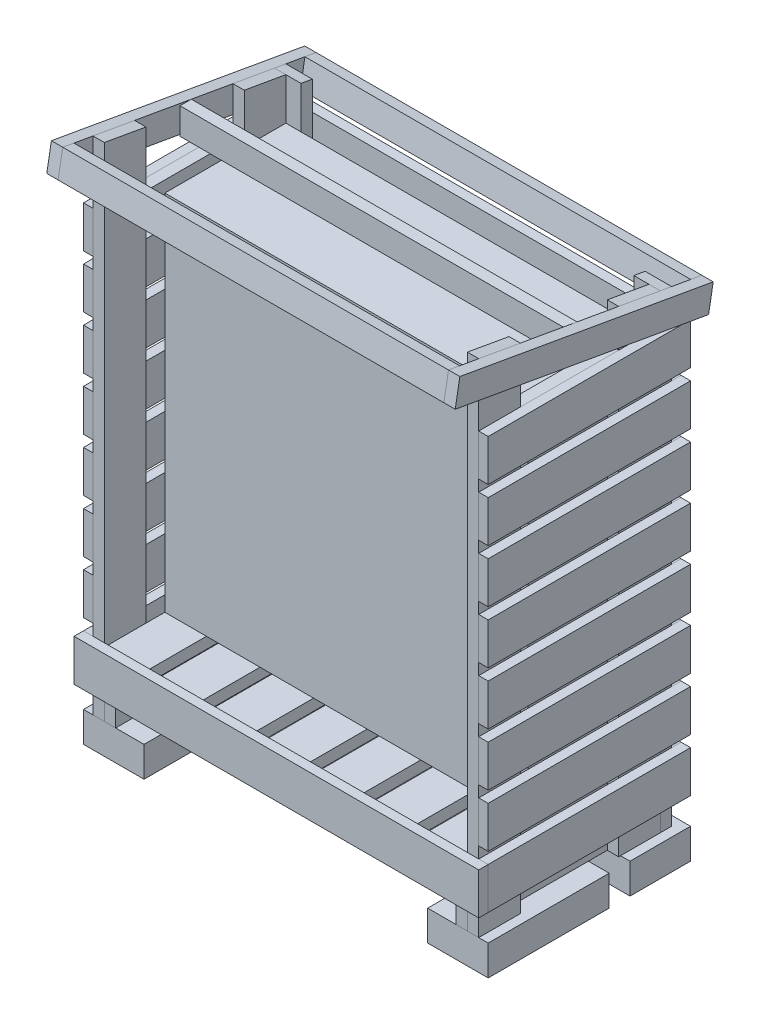
from build123d import *

# Parameters (mm, degrees)
SKETCH5_W              = 38.1
SKETCH5_H              = 609.6
BOSS_EXTRUDE2_DEPTH    = 88.9
BOSS_EXTRUDE2_2_DEPTH  = 88.9
SKETCH6_W              = 1219.2
SKETCH6_H              = 38.1
BOSS_EXTRUDE3_DEPTH    = 88.9
BOSS_EXTRUDE3_2_DEPTH  = 88.9
SKETCH7_W              = 139.7
SKETCH7_H              = 609.6
BOSS_EXTRUDE4_DEPTH    = 38.1
BOSS_EXTRUDE4_2_DEPTH  = 38.1
BOSS_EXTRUDE4_3_DEPTH  = 38.1
BOSS_EXTRUDE4_4_DEPTH  = 38.1
BOSS_EXTRUDE4_5_DEPTH  = 38.1
BOSS_EXTRUDE4_6_DEPTH  = 38.1
BOSS_EXTRUDE4_7_DEPTH  = 38.1
SKETCH10_W             = 38.1
SKETCH10_H             = 139.7
BOSS_EXTRUDE7_DEPTH    = 1828.8
BOSS_EXTRUDE7_2_DEPTH  = 1828.8
BOSS_EXTRUDE7_3_DEPTH  = 1828.8
BOSS_EXTRUDE7_4_DEPTH  = 1828.8
SKETCH16_W             = 88.9
SKETCH16_H             = 38.1
BOSS_EXTRUDE11_DEPTH   = 1828.8
BOSS_EXTRUDE11_2_DEPTH = 1828.8
SKETCH12_W             = 1219.1492
SKETCH12_H             = 406.4
BOSS_EXTRUDE8_DEPTH    = 1219.2
BOSS_EXTRUDE9_DEPTH    = 38.1
CUT_EXTRUDE1_DEPTH     = 2237.750882419
BOSS_EXTRUDE10_DEPTH   = 1295.4
BOSS_EXTRUDE10_2_DEPTH = 1295.4
SKETCH15_W             = 38.1
SKETCH15_H             = 88.9
BOSS_EXTRUDE10_3_DEPTH = 1295.4
SKETCH18_W             = 1295.4
SKETCH18_H             = 139.7
BOSS_EXTRUDE12_DEPTH   = 31.75
BOSS_EXTRUDE12_2_DEPTH = 31.75
BOSS_EXTRUDE12_3_DEPTH = 31.75
BOSS_EXTRUDE12_4_DEPTH = 31.75
BOSS_EXTRUDE12_5_DEPTH = 31.75
BOSS_EXTRUDE12_6_DEPTH = 31.75
BOSS_EXTRUDE12_7_DEPTH = 31.75
BOSS_EXTRUDE12_8_DEPTH = 31.75
SKETCH20_W             = 679.45
SKETCH20_H             = 139.7
BOSS_EXTRUDE13_DEPTH   = 31.75
BOSS_EXTRUDE13_2_DEPTH = 31.75
BOSS_EXTRUDE13_3_DEPTH = 31.75
BOSS_EXTRUDE13_4_DEPTH = 31.75
BOSS_EXTRUDE13_5_DEPTH = 31.75
BOSS_EXTRUDE13_6_DEPTH = 31.75
BOSS_EXTRUDE13_7_DEPTH = 31.75
BOSS_EXTRUDE13_8_DEPTH = 31.75
SKETCH21_W             = 203.2
SKETCH21_H             = 406.4
BOSS_EXTRUDE14_DEPTH   = 101.6
BOSS_EXTRUDE14_2_DEPTH = 101.6
SKETCH21_W_2           = 406.4
SKETCH21_H_2           = 203.2
BOSS_EXTRUDE14_3_DEPTH = 101.6
BOSS_EXTRUDE14_4_DEPTH = 101.6
SKETCH22_W             = 1358.9
SKETCH22_H             = 139.7
BOSS_EXTRUDE15_DEPTH   = 31.75
SKETCH23_W             = 38.1
SKETCH23_H             = 88.9
BOSS_EXTRUDE16_DEPTH   = 330.2
BOSS_EXTRUDE16_2_DEPTH = 330.2


with BuildPart() as part:
    # Sketch5 → Boss-Extrude2 (new body)
    with BuildSketch(Plane(origin=(0, 0, 0), x_dir=(1, 0, 0), z_dir=(0, 1, 0))):
        with Locations((-590.55, 0)):
            Rectangle(SKETCH5_W, SKETCH5_H)
    extrude(amount=-BOSS_EXTRUDE2_DEPTH)


with BuildPart() as body_2:
    # Sketch5 → Boss-Extrude2 2 (new body)
    with BuildSketch(Plane(origin=(0, 0, 0), x_dir=(1, 0, 0), z_dir=(0, 1, 0))):
        with Locations((590.55, 0)):
            Rectangle(SKETCH5_W, SKETCH5_H)
    extrude(amount=-BOSS_EXTRUDE2_2_DEPTH)


with BuildPart() as body_3:
    # Sketch6 → Boss-Extrude3 (new body)
    with BuildSketch(Plane(origin=(0, 0, 0), x_dir=(1, 0, 0), z_dir=(0, 1, 0))):
        with Locations((0, -285.75)):
            Rectangle(SKETCH6_W, SKETCH6_H)
    extrude(amount=BOSS_EXTRUDE3_DEPTH)


with BuildPart() as body_4:
    # Sketch6 → Boss-Extrude3 2 (new body)
    with BuildSketch(Plane(origin=(0, 0, 0), x_dir=(1, 0, 0), z_dir=(0, 1, 0))):
        with Locations((0, 285.75)):
            Rectangle(SKETCH6_W, SKETCH6_H)
    extrude(amount=BOSS_EXTRUDE3_2_DEPTH)


with BuildPart() as body_5:
    # Sketch7 → Boss-Extrude4 (new body)
    with BuildSketch(Plane(origin=(0, 88.9, 0), x_dir=(1, 0, 0), z_dir=(0, 1, 0))):
        with Locations((-539.75, 0)):
            Rectangle(SKETCH7_W, SKETCH7_H)
    extrude(amount=BOSS_EXTRUDE4_DEPTH)


with BuildPart() as body_6:
    # Sketch7 → Boss-Extrude4 2 (new body)
    with BuildSketch(Plane(origin=(0, 88.9, 0), x_dir=(1, 0, 0), z_dir=(0, 1, 0))):
        with Locations((-359.8418, 0)):
            Rectangle(SKETCH7_W, SKETCH7_H)
    extrude(amount=BOSS_EXTRUDE4_2_DEPTH)


with BuildPart() as body_7:
    # Sketch7 → Boss-Extrude4 3 (new body)
    with BuildSketch(Plane(origin=(0, 88.9, 0), x_dir=(1, 0, 0), z_dir=(0, 1, 0))):
        with Locations((-179.9336, 0)):
            Rectangle(SKETCH7_W, SKETCH7_H)
    extrude(amount=BOSS_EXTRUDE4_3_DEPTH)


with BuildPart() as body_8:
    # Sketch7 → Boss-Extrude4 4 (new body)
    with BuildSketch(Plane(origin=(0, 88.9, 0), x_dir=(1, 0, 0), z_dir=(0, 1, 0))):
        with Locations((-0.0254, 0)):
            Rectangle(SKETCH7_W, SKETCH7_H)
    extrude(amount=BOSS_EXTRUDE4_4_DEPTH)


with BuildPart() as body_9:
    # Sketch7 → Boss-Extrude4 5 (new body)
    with BuildSketch(Plane(origin=(0, 88.9, 0), x_dir=(1, 0, 0), z_dir=(0, 1, 0))):
        with Locations((179.8828, 0)):
            Rectangle(SKETCH7_W, SKETCH7_H)
    extrude(amount=BOSS_EXTRUDE4_5_DEPTH)


with BuildPart() as body_10:
    # Sketch7 → Boss-Extrude4 6 (new body)
    with BuildSketch(Plane(origin=(0, 88.9, 0), x_dir=(1, 0, 0), z_dir=(0, 1, 0))):
        with Locations((359.791, 0)):
            Rectangle(SKETCH7_W, SKETCH7_H)
    extrude(amount=BOSS_EXTRUDE4_6_DEPTH)


with BuildPart() as body_11:
    # Sketch7 → Boss-Extrude4 7 (new body)
    with BuildSketch(Plane(origin=(0, 88.9, 0), x_dir=(1, 0, 0), z_dir=(0, 1, 0))):
        with Locations((539.6992, 0)):
            Rectangle(SKETCH7_W, SKETCH7_H)
    extrude(amount=BOSS_EXTRUDE4_7_DEPTH)


with BuildPart() as body_12:
    # Sketch10 → Boss-Extrude7 (new body)
    with BuildSketch(Plane.XZ.offset(88.9)):
        with Locations((-628.65, 234.95)):
            Rectangle(SKETCH10_W, SKETCH10_H)
    extrude(amount=-BOSS_EXTRUDE7_DEPTH)


with BuildPart() as body_13:
    # Sketch10 → Boss-Extrude7 2 (new body)
    with BuildSketch(Plane.XZ.offset(88.9)):
        with Locations((-628.65, -234.95)):
            Rectangle(SKETCH10_W, SKETCH10_H)
    extrude(amount=-BOSS_EXTRUDE7_2_DEPTH)


with BuildPart() as body_14:
    # Sketch10 → Boss-Extrude7 3 (new body)
    with BuildSketch(Plane.XZ.offset(88.9)):
        with Locations((628.65, 234.95)):
            Rectangle(SKETCH10_W, SKETCH10_H)
    extrude(amount=-BOSS_EXTRUDE7_3_DEPTH)


with BuildPart() as body_15:
    # Sketch10 → Boss-Extrude7 4 (new body)
    with BuildSketch(Plane.XZ.offset(88.9)):
        with Locations((628.65, -234.95)):
            Rectangle(SKETCH10_W, SKETCH10_H)
    extrude(amount=-BOSS_EXTRUDE7_4_DEPTH)


with BuildPart() as body_16:
    # Sketch16 → Boss-Extrude11 (new body)
    with BuildSketch(Plane.XZ.offset(88.9)):
        with Locations((-603.25, -323.85)):
            Rectangle(SKETCH16_W, SKETCH16_H)
    extrude(amount=-BOSS_EXTRUDE11_DEPTH)


with BuildPart() as body_17:
    # Sketch16 → Boss-Extrude11 2 (new body)
    with BuildSketch(Plane.XZ.offset(88.9)):
        with Locations((603.25, -323.85)):
            Rectangle(SKETCH16_W, SKETCH16_H)
    extrude(amount=-BOSS_EXTRUDE11_2_DEPTH)


with BuildPart() as body_18:
    # Sketch12 → Boss-Extrude8 (new body)
    with BuildSketch(Plane(origin=(0, 127, 0), x_dir=(1, 0, 0), z_dir=(0, 1, 0))):
        with Locations((-0.0254, 101.6)):
            Rectangle(SKETCH12_W, SKETCH12_H)
    extrude(amount=BOSS_EXTRUDE8_DEPTH)


with BuildPart() as body_19:
    # Sketch13 → Boss-Extrude9 (new body)
    with BuildSketch(Plane(origin=(647.7, 0, 0), x_dir=(0, 0, -1), z_dir=(1, 0, 0))):
        Polygon((429.062677005, 1375.089137349), (-421.837322995, 1525.125765234), (-406.4, 1612.675174476), (444.5, 1462.638546592), align=None)
    extrude(amount=BOSS_EXTRUDE9_DEPTH)


with BuildPart() as body_20:
    # Mirror1: mirrored copy
    add(body_19.part.mirror(Plane(origin=(0, 0, 0), x_dir=(0, 0, 1), z_dir=(1, 0, 0))))


with BuildPart() as cut_extrude1_tool:
    # Sketch14 → Cut-Extrude1 (new, through all)
    with BuildSketch(Plane(origin=(647.7, 0, 0), x_dir=(0, 0, -1), z_dir=(1, 0, 0))):
        Polygon((-304.8, 1739.9), (-304.8, 1594.760353237), (342.9, 1480.553367832), (342.9, 1739.9), align=None)
    extrude(amount=-CUT_EXTRUDE1_DEPTH)


with BuildPart() as body_12_1:
    add(body_12.part)

    # Cut-Extrude1: cut by cut_extrude1_tool
    add(cut_extrude1_tool.part, mode=Mode.SUBTRACT)


with BuildPart() as body_13_1:
    add(body_13.part)

    # Cut-Extrude1: cut by cut_extrude1_tool
    add(cut_extrude1_tool.part, mode=Mode.SUBTRACT)


with BuildPart() as body_14_1:
    add(body_14.part)

    # Cut-Extrude1: cut by cut_extrude1_tool
    add(cut_extrude1_tool.part, mode=Mode.SUBTRACT)


with BuildPart() as body_15_1:
    add(body_15.part)

    # Cut-Extrude1: cut by cut_extrude1_tool
    add(cut_extrude1_tool.part, mode=Mode.SUBTRACT)


with BuildPart() as body_16_1:
    add(body_16.part)

    # Cut-Extrude1: cut by cut_extrude1_tool
    add(cut_extrude1_tool.part, mode=Mode.SUBTRACT)


with BuildPart() as body_17_1:
    add(body_17.part)

    # Cut-Extrude1: cut by cut_extrude1_tool
    add(cut_extrude1_tool.part, mode=Mode.SUBTRACT)


with BuildPart() as body_21:
    # Sketch15 → Boss-Extrude10 (new body)
    with BuildSketch(Plane(origin=(-647.7, 0, 0), x_dir=(0, 0, -1), z_dir=(1, 0, 0))):
        Polygon((-406.4, 1612.675174476), (-421.837322995, 1525.125765234), (-384.316147605, 1518.509769665), (-368.87882461, 1606.059178907), align=None)
    extrude(amount=BOSS_EXTRUDE10_DEPTH)


with BuildPart() as body_22:
    # Sketch15 → Boss-Extrude10 2 (new body)
    with BuildSketch(Plane(origin=(-647.7, 0, 0), x_dir=(0, 0, -1), z_dir=(1, 0, 0))):
        Polygon((444.5, 1462.638546592), (406.97882461, 1469.254542161), (391.541501616, 1381.705132918), (429.062677005, 1375.089137349), align=None)
    extrude(amount=BOSS_EXTRUDE10_2_DEPTH)


with BuildPart() as body_23:
    # Sketch15 → Boss-Extrude10 3 (new body)
    with BuildSketch(Plane(origin=(-647.7, 0, 0), x_dir=(0, 0, -1), z_dir=(1, 0, 0))):
        with Locations((6.35, 1492.087184207)):
            Rectangle(SKETCH15_W, SKETCH15_H)
    extrude(amount=BOSS_EXTRUDE10_3_DEPTH)


with BuildPart() as body_24:
    # Sketch18 → Boss-Extrude12 (new body)
    with BuildSketch(Plane(origin=(0, 0, -342.9), x_dir=(-1, 0, 0), z_dir=(0, 0, -1))):
        with Locations((0, 69.85)):
            Rectangle(SKETCH18_W, SKETCH18_H)
    extrude(amount=BOSS_EXTRUDE12_DEPTH)


with BuildPart() as body_25:
    # Sketch18 → Boss-Extrude12 2 (new body)
    with BuildSketch(Plane(origin=(0, 0, -342.9), x_dir=(-1, 0, 0), z_dir=(0, 0, -1))):
        with Locations((0, 958.85)):
            Rectangle(SKETCH18_W, SKETCH18_H)
    extrude(amount=BOSS_EXTRUDE12_2_DEPTH)


with BuildPart() as body_26:
    # Sketch18 → Boss-Extrude12 3 (new body)
    with BuildSketch(Plane(origin=(0, 0, -342.9), x_dir=(-1, 0, 0), z_dir=(0, 0, -1))):
        with Locations((0, 247.65)):
            Rectangle(SKETCH18_W, SKETCH18_H)
    extrude(amount=BOSS_EXTRUDE12_3_DEPTH)


with BuildPart() as body_27:
    # Sketch18 → Boss-Extrude12 4 (new body)
    with BuildSketch(Plane(origin=(0, 0, -342.9), x_dir=(-1, 0, 0), z_dir=(0, 0, -1))):
        with Locations((0, 425.45)):
            Rectangle(SKETCH18_W, SKETCH18_H)
    extrude(amount=BOSS_EXTRUDE12_4_DEPTH)


with BuildPart() as body_28:
    # Sketch18 → Boss-Extrude12 5 (new body)
    with BuildSketch(Plane(origin=(0, 0, -342.9), x_dir=(-1, 0, 0), z_dir=(0, 0, -1))):
        with Locations((0, 603.25)):
            Rectangle(SKETCH18_W, SKETCH18_H)
    extrude(amount=BOSS_EXTRUDE12_5_DEPTH)


with BuildPart() as body_29:
    # Sketch18 → Boss-Extrude12 6 (new body)
    with BuildSketch(Plane(origin=(0, 0, -342.9), x_dir=(-1, 0, 0), z_dir=(0, 0, -1))):
        with Locations((0, 781.05)):
            Rectangle(SKETCH18_W, SKETCH18_H)
    extrude(amount=BOSS_EXTRUDE12_6_DEPTH)


with BuildPart() as body_30:
    # Sketch18 → Boss-Extrude12 7 (new body)
    with BuildSketch(Plane(origin=(0, 0, -342.9), x_dir=(-1, 0, 0), z_dir=(0, 0, -1))):
        with Locations((0, 1136.65)):
            Rectangle(SKETCH18_W, SKETCH18_H)
    extrude(amount=BOSS_EXTRUDE12_7_DEPTH)


with BuildPart() as body_31:
    # Sketch18 → Boss-Extrude12 8 (new body)
    with BuildSketch(Plane(origin=(0, 0, -342.9), x_dir=(-1, 0, 0), z_dir=(0, 0, -1))):
        with Locations((0, 1314.45)):
            Rectangle(SKETCH18_W, SKETCH18_H)
    extrude(amount=BOSS_EXTRUDE12_8_DEPTH)


with BuildPart() as body_32:
    # Sketch20 → Boss-Extrude13 (new body)
    with BuildSketch(Plane(origin=(647.7, 0, 0), x_dir=(0, 0, -1), z_dir=(1, 0, 0))):
        with Locations((34.925, 69.85)):
            Rectangle(SKETCH20_W, SKETCH20_H)
    extrude(amount=BOSS_EXTRUDE13_DEPTH)


with BuildPart() as body_33:
    # Sketch20 → Boss-Extrude13 2 (new body)
    with BuildSketch(Plane(origin=(647.7, 0, 0), x_dir=(0, 0, -1), z_dir=(1, 0, 0))):
        with Locations((34.925, 247.65)):
            Rectangle(SKETCH20_W, SKETCH20_H)
    extrude(amount=BOSS_EXTRUDE13_2_DEPTH)


with BuildPart() as body_34:
    # Sketch20 → Boss-Extrude13 3 (new body)
    with BuildSketch(Plane(origin=(647.7, 0, 0), x_dir=(0, 0, -1), z_dir=(1, 0, 0))):
        with Locations((34.925, 425.45)):
            Rectangle(SKETCH20_W, SKETCH20_H)
    extrude(amount=BOSS_EXTRUDE13_3_DEPTH)


with BuildPart() as body_35:
    # Sketch20 → Boss-Extrude13 4 (new body)
    with BuildSketch(Plane(origin=(647.7, 0, 0), x_dir=(0, 0, -1), z_dir=(1, 0, 0))):
        with Locations((34.925, 603.25)):
            Rectangle(SKETCH20_W, SKETCH20_H)
    extrude(amount=BOSS_EXTRUDE13_4_DEPTH)


with BuildPart() as body_36:
    # Sketch20 → Boss-Extrude13 5 (new body)
    with BuildSketch(Plane(origin=(647.7, 0, 0), x_dir=(0, 0, -1), z_dir=(1, 0, 0))):
        with Locations((34.925, 781.05)):
            Rectangle(SKETCH20_W, SKETCH20_H)
    extrude(amount=BOSS_EXTRUDE13_5_DEPTH)


with BuildPart() as body_37:
    # Sketch20 → Boss-Extrude13 6 (new body)
    with BuildSketch(Plane(origin=(647.7, 0, 0), x_dir=(0, 0, -1), z_dir=(1, 0, 0))):
        with Locations((34.925, 958.85)):
            Rectangle(SKETCH20_W, SKETCH20_H)
    extrude(amount=BOSS_EXTRUDE13_6_DEPTH)


with BuildPart() as body_38:
    # Sketch20 → Boss-Extrude13 7 (new body)
    with BuildSketch(Plane(origin=(647.7, 0, 0), x_dir=(0, 0, -1), z_dir=(1, 0, 0))):
        with Locations((34.925, 1136.65)):
            Rectangle(SKETCH20_W, SKETCH20_H)
    extrude(amount=BOSS_EXTRUDE13_7_DEPTH)


with BuildPart() as body_39:
    # Sketch20 → Boss-Extrude13 8 (new body)
    with BuildSketch(Plane(origin=(647.7, 0, 0), x_dir=(0, 0, -1), z_dir=(1, 0, 0))):
        with Locations((34.925, 1314.45)):
            Rectangle(SKETCH20_W, SKETCH20_H)
    extrude(amount=BOSS_EXTRUDE13_8_DEPTH)


with BuildPart() as body_40:
    # Mirror2: mirrored copy
    add(body_36.part.mirror(Plane(origin=(0, 0, 0), x_dir=(0, 0, 1), z_dir=(1, 0, 0))))


with BuildPart() as body_41:
    # Mirror2 2: mirrored copy
    add(body_35.part.mirror(Plane(origin=(0, 0, 0), x_dir=(0, 0, 1), z_dir=(1, 0, 0))))


with BuildPart() as body_42:
    # Mirror2 3: mirrored copy
    add(body_34.part.mirror(Plane(origin=(0, 0, 0), x_dir=(0, 0, 1), z_dir=(1, 0, 0))))


with BuildPart() as body_43:
    # Mirror2 4: mirrored copy
    add(body_33.part.mirror(Plane(origin=(0, 0, 0), x_dir=(0, 0, 1), z_dir=(1, 0, 0))))


with BuildPart() as body_44:
    # Mirror2 5: mirrored copy
    add(body_32.part.mirror(Plane(origin=(0, 0, 0), x_dir=(0, 0, 1), z_dir=(1, 0, 0))))


with BuildPart() as body_45:
    # Mirror2 6: mirrored copy
    add(body_37.part.mirror(Plane(origin=(0, 0, 0), x_dir=(0, 0, 1), z_dir=(1, 0, 0))))


with BuildPart() as body_46:
    # Mirror2 7: mirrored copy
    add(body_38.part.mirror(Plane(origin=(0, 0, 0), x_dir=(0, 0, 1), z_dir=(1, 0, 0))))


with BuildPart() as body_47:
    # Mirror2 8: mirrored copy
    add(body_39.part.mirror(Plane(origin=(0, 0, 0), x_dir=(0, 0, 1), z_dir=(1, 0, 0))))


with BuildPart() as body_48:
    # Sketch21 → Boss-Extrude14 (new body)
    with BuildSketch(Plane.XZ.offset(88.9)):
        with Locations((-577.85, 101.6)):
            Rectangle(SKETCH21_W, SKETCH21_H)
    extrude(amount=BOSS_EXTRUDE14_DEPTH)


with BuildPart() as body_49:
    # Sketch21 → Boss-Extrude14 2 (new body)
    with BuildSketch(Plane.XZ.offset(88.9)):
        with Locations((577.85, 101.6)):
            Rectangle(SKETCH21_W, SKETCH21_H)
    extrude(amount=BOSS_EXTRUDE14_2_DEPTH)


with BuildPart() as body_50:
    # Sketch21 → Boss-Extrude14 3 (new body)
    with BuildSketch(Plane.XZ.offset(88.9)):
        with Locations((-476.25, -273.05)):
            Rectangle(SKETCH21_W_2, SKETCH21_H_2)
    extrude(amount=BOSS_EXTRUDE14_3_DEPTH)


with BuildPart() as body_51:
    # Sketch21 → Boss-Extrude14 4 (new body)
    with BuildSketch(Plane.XZ.offset(88.9)):
        with Locations((476.25, -273.05)):
            Rectangle(SKETCH21_W_2, SKETCH21_H_2)
    extrude(amount=BOSS_EXTRUDE14_4_DEPTH)


with BuildPart() as body_52:
    # Sketch22 → Boss-Extrude15 (new body)
    with BuildSketch(Plane.XY.offset(304.8)):
        with Locations((0, 69.85)):
            Rectangle(SKETCH22_W, SKETCH22_H)
    extrude(amount=BOSS_EXTRUDE15_DEPTH)


with BuildPart() as body_53:
    # Sketch23 → Boss-Extrude16 (new body)
    with BuildSketch(Plane.XY.offset(-165.1)):
        with Locations((-628.65, 1339.85)):
            Rectangle(SKETCH23_W, SKETCH23_H)
    extrude(amount=BOSS_EXTRUDE16_DEPTH)


with BuildPart() as body_54:
    # Sketch23 → Boss-Extrude16 2 (new body)
    with BuildSketch(Plane.XY.offset(-165.1)):
        with Locations((628.65, 1339.85)):
            Rectangle(SKETCH23_W, SKETCH23_H)
    extrude(amount=BOSS_EXTRUDE16_2_DEPTH)


solid = Compound([part.part, body_2.part, body_3.part, body_4.part, body_5.part, body_6.part, body_7.part, body_8.part, body_9.part, body_10.part, body_11.part, body_18.part, body_19.part, body_20.part, body_12_1.part, body_13_1.part, body_14_1.part, body_15_1.part, body_16_1.part, body_17_1.part, body_21.part, body_22.part, body_23.part, body_24.part, body_25.part, body_26.part, body_27.part, body_28.part, body_29.part, body_30.part, body_31.part, body_32.part, body_33.part, body_34.part, body_35.part, body_36.part, body_37.part, body_38.part, body_39.part, body_40.part, body_41.part, body_42.part, body_43.part, body_44.part, body_45.part, body_46.part, body_47.part, body_48.part, body_49.part, body_50.part, body_51.part, body_52.part, body_53.part, body_54.part])
